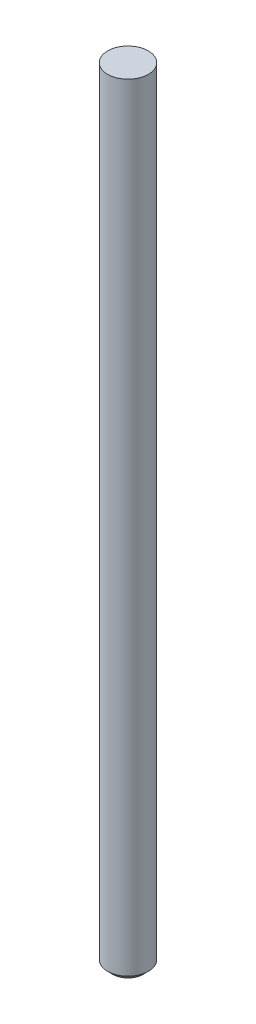
from build123d import *

# Parameters (mm, degrees)
SKETCH1_R           = 3.9
BOSS_EXTRUDE1_DEPTH = 150
CHAMFER1_SIZE       = 1


with BuildPart() as part:
    # Sketch1 → Boss-Extrude1 (new body)
    with BuildSketch(Plane(origin=(0, 0, 0), x_dir=(1, 0, 0), z_dir=(0, 1, 0))):
        with Locations(Location((0, 0, 0), (0, 0, 270))):
            Circle(SKETCH1_R)
    extrude(amount=BOSS_EXTRUDE1_DEPTH)

    # Chamfer1
    chamfer1_edges = [part.edges().sort_by_distance(p)[0] for p in [
        (0, 0, -3.9),
    ]]
    chamfer(chamfer1_edges, length=CHAMFER1_SIZE)


solid = part.part
